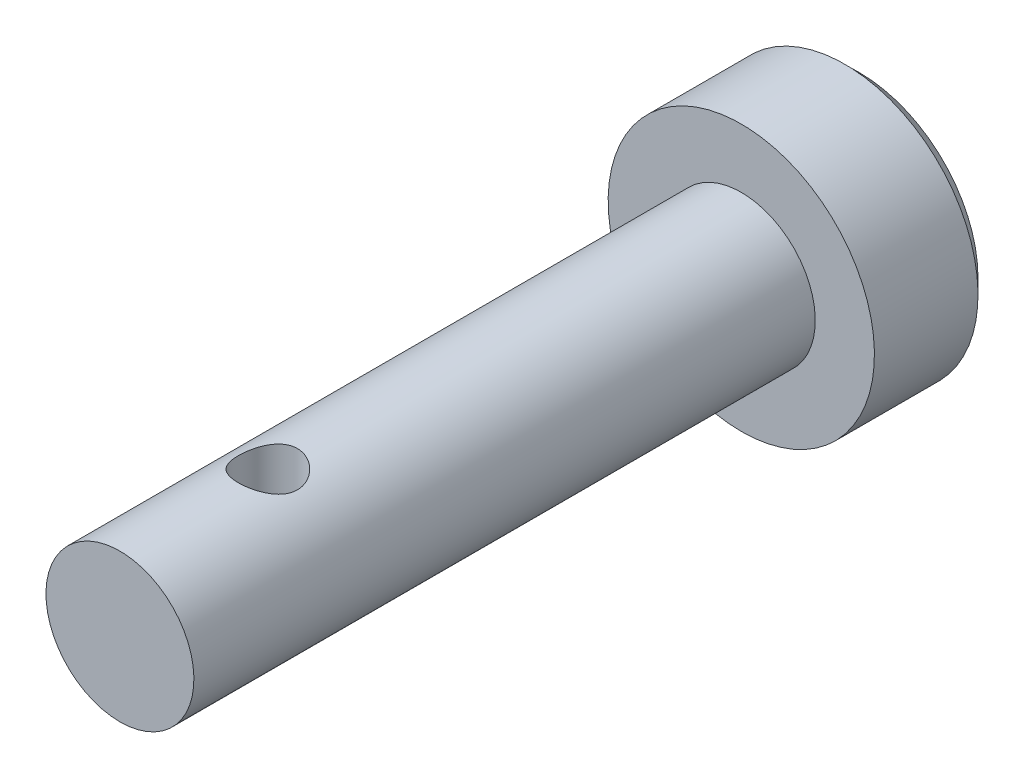
from build123d import *

# Parameters (mm, degrees)
MM_1_D         = 4
CHAMFER_1_SIZE = 1


with BuildPart() as part:
    # 草图1 → 旋转1 (revolve)
    with BuildSketch(Plane(origin=(0, 0, 0), x_dir=(0, 0, -1), z_dir=(1, 0, 0)), mode=Mode.PRIVATE) as revolve_1_sk:
        Polygon((0, 0), (0, 9), (-8, 9), (-8, 5), (-50, 5), (-50, 0), align=None)
    revolve(revolve_1_sk.sketch.rotate(Axis((0, 0, 50), (0, 0, -1)), 180), axis=Axis((0, 0, 50), (0, 0, -1)))

    # 大小mm 暗销孔1 (through all)
    with Locations(Plane(origin=(0, 5, 40), x_dir=(1, 0, 0), z_dir=(0, 1, 0))):
        with Locations((0, 0)):
            Hole(MM_1_D / 2)

    # 倒角1
    chamfer_1_edges = [part.edges().sort_by_distance(p)[0] for p in [
        (0, 9, 0),
    ]]
    chamfer(chamfer_1_edges, length=CHAMFER_1_SIZE)


solid = part.part
